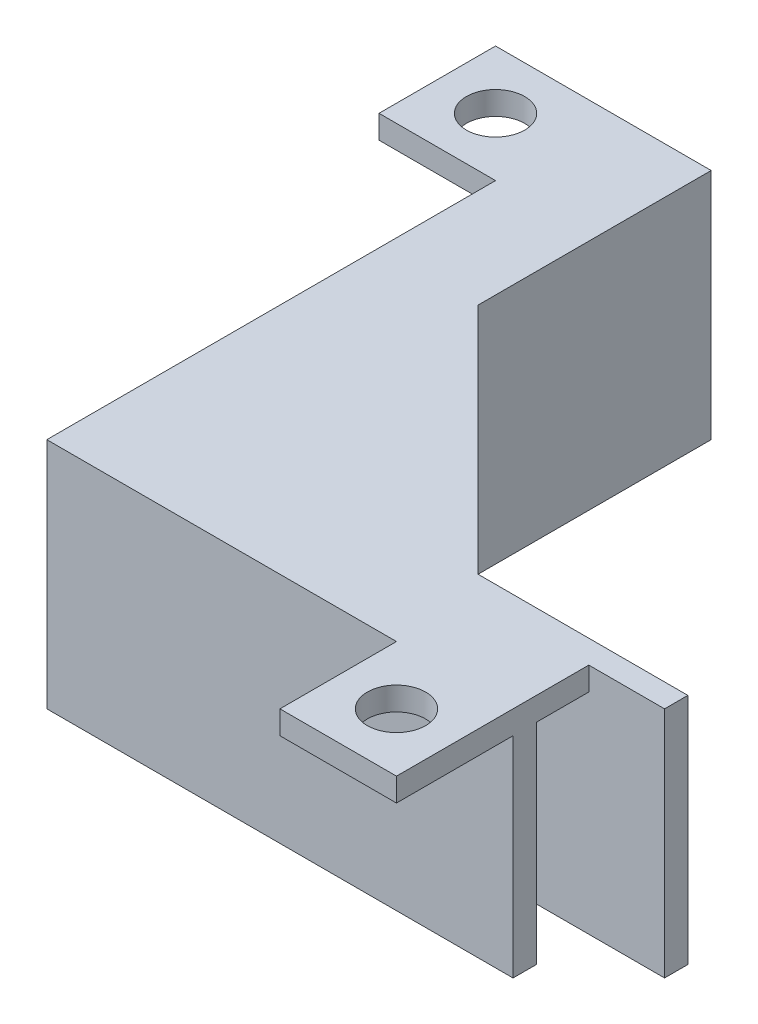
from build123d import *

# Parameters (mm, degrees)
WALLS_DEPTH         = 20
WALLS_2_DEPTH       = 20
REST_ON_THIS_DEPTH  = 2
SKETCH2_W           = 10
SKETCH2_H           = 10
SKETCH2_R           = 2.5
BOSS_EXTRUDE3_DEPTH = 2


with BuildPart() as part:
    # Sketch1 → Walls (new body)
    with BuildSketch(Plane(origin=(0, 0, 0), x_dir=(1, 0, 0), z_dir=(0, 1, 0))):
        Polygon((-18.503168436, 25.037980983), (-20.503168436, 25.037980983), (-20.503168436, -23.462019017), (19.496831564, -23.462019017), (19.496831564, -21.462019017), (-18.503168436, -21.462019017), align=None)
    extrude(amount=-WALLS_DEPTH)



with BuildPart() as body_2:
    # Sketch1 → Walls 2 (new body)
    with BuildSketch(Plane(origin=(0, 0, 0), x_dir=(1, 0, 0), z_dir=(0, 1, 0))):
        Polygon((-12.003168436, 25.037980983), (-14.003168436, 25.037980983), (-14.003168436, -16.962019017), (25.996831564, -16.962019017), (25.996831564, -14.962019017), (-12.003168436, -14.962019017), align=None)
    extrude(amount=-WALLS_2_DEPTH)


with BuildPart() as part_1:
    add(part.part)

    add(body_2.part)  # Rest on this merges body 2
    # Sketch1<3> → Rest on this (add)
    with BuildSketch(Plane(origin=(0, 0, 0), x_dir=(1, 0, 0), z_dir=(0, 1, 0))):
        Polygon((-14.003168436, 25.037980983), (-18.503168436, 25.037980983), (-18.503168436, -21.462019017), (19.496831564, -21.462019017), (19.496831564, -16.962019017), (-14.003168436, -16.962019017), align=None)
    extrude(amount=-REST_ON_THIS_DEPTH)

    # Sketch2 → Boss-Extrude3 (add)
    # profile 1 of 3: a face of its own
    with BuildSketch(Plane(origin=(0, 0, 0), x_dir=(1, 0, 0), z_dir=(0, 1, 0))):
        Polygon((7.996831564, -14.962019017), (-12.003168436, 5.037980983), (-12.003168436, -14.962019017), align=None)
    # profile 2 of 3: a face of its own
    with BuildSketch(Plane(origin=(0, 0, 0), x_dir=(1, 0, 0), z_dir=(0, 1, 0))):
        with Locations((14.496831564, -28.462019017)):
            Rectangle(SKETCH2_W, SKETCH2_H)
        with Locations((14.496831564, -28.462019017)):
            Circle(SKETCH2_R, mode=Mode.SUBTRACT)
    # profile 3 of 3: a face of its own
    with BuildSketch(Plane(origin=(0, 0, 0), x_dir=(1, 0, 0), z_dir=(0, 1, 0))):
        with Locations((-25.503168436, 20.037980983)):
            Rectangle(SKETCH2_W, SKETCH2_H)
        with Locations((-25.503168436, 20.037980983)):
            Circle(SKETCH2_R, mode=Mode.SUBTRACT)
    extrude(amount=-BOSS_EXTRUDE3_DEPTH)


solid = part_1.part
